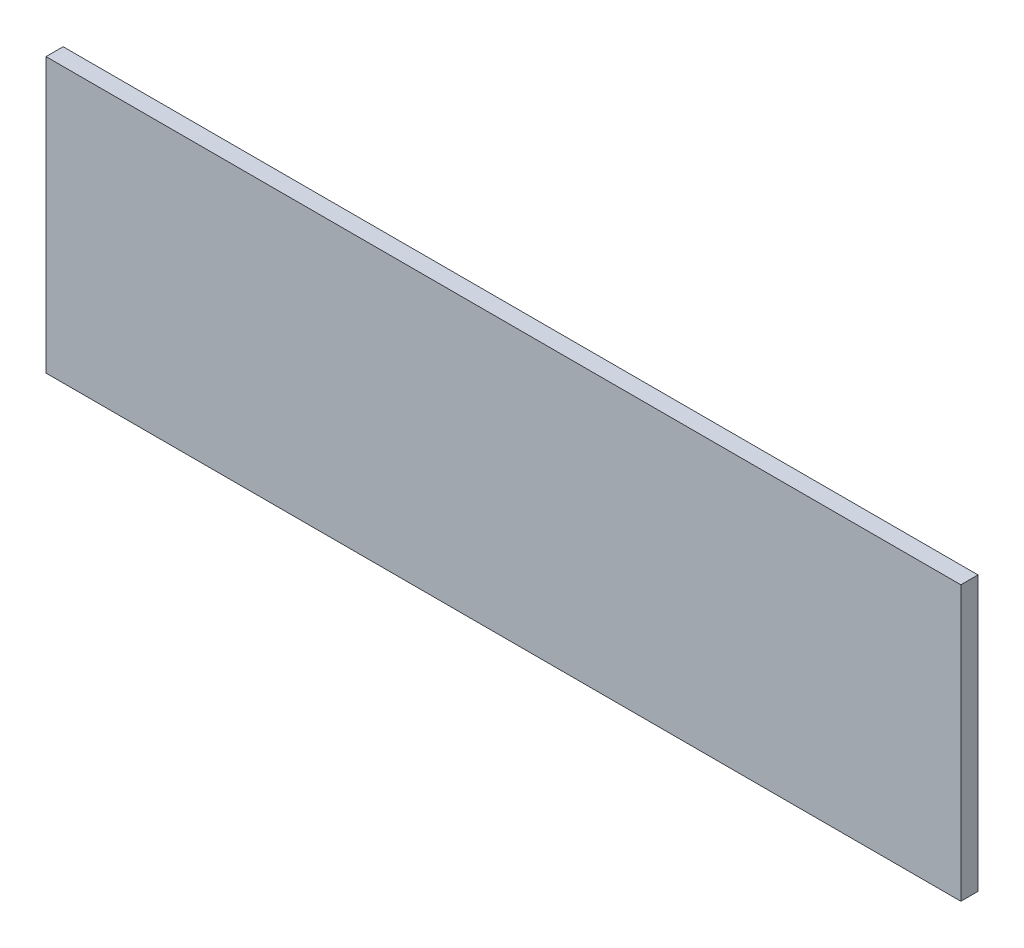
from build123d import *

# Parameters (mm, degrees)
ESQUISSE1_W        = 267
ESQUISSE1_H        = 80
BOSS_EXTRU_1_DEPTH = 5


with BuildPart() as part:
    # Esquisse1 → Boss.-Extru.1 (new body)
    with BuildSketch(Plane.XY):
        Rectangle(ESQUISSE1_W, ESQUISSE1_H)
    extrude(amount=BOSS_EXTRU_1_DEPTH)


solid = part.part
